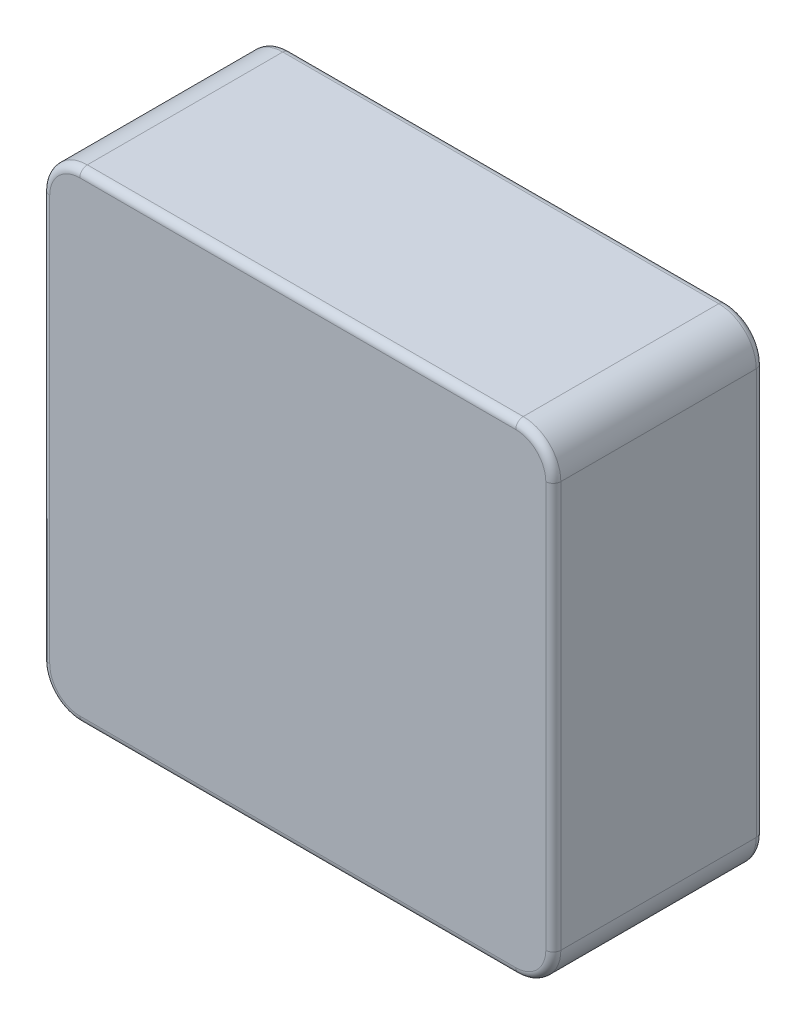
from build123d import *

# Parameters (mm, degrees)
BOSS_EXTRUDE1_DEPTH = 2.8
SKETCH2_W           = 5.05
SKETCH2_H           = 1.4
BOSS_EXTRUDE2_DEPTH = 0.1
FILLET1_R           = 0.1


with BuildPart() as part:
    # Sketch1 → Boss-Extrude1 (new body)
    with BuildSketch(Plane.XY):
        with BuildLine():
            Line((-2.9, -3.2), (2.9, -3.2))
            ThreePointArc((2.9, -3.2), (3.253553391, -3.053553391), (3.4, -2.7))
            Line((3.4, -2.7), (3.4, 2.7))
            ThreePointArc((3.4, 2.7), (3.253553391, 3.053553391), (2.9, 3.2))
            Line((2.9, 3.2), (-2.9, 3.2))
            ThreePointArc((-2.9, 3.2), (-3.253553391, 3.053553391), (-3.4, 2.7))
            Line((-3.4, 2.7), (-3.4, -2.7))
            ThreePointArc((-3.4, -2.7), (-3.253553391, -3.053553391), (-2.9, -3.2))
        make_face()
    extrude(amount=BOSS_EXTRUDE1_DEPTH)

    # Sketch2 → Boss-Extrude2 (add)
    with BuildSketch(Plane(origin=(0, 0, 0), x_dir=(-1, 0, 0), z_dir=(0, 0, -1))):
        with Locations((0, 2)):
            Rectangle(SKETCH2_W, SKETCH2_H)
        with Locations((0, -2)):
            Rectangle(SKETCH2_W, SKETCH2_H)
    extrude(amount=BOSS_EXTRUDE2_DEPTH)

    # Fillet1
    fillet1_edges = [part.edges().sort_by_distance(p)[0] for p in [
        (3.253553391, 3.053553391, 2.8),
        (3.4, 0, 0),
        (3.253553391, -3.053553391, 0),
        (0, 3.2, 2.8),
        (-3.253553391, 3.053553391, 2.8),
        (-3.4, 0, 2.8),
        (-3.253553391, -3.053553391, 2.8),
        (0, -3.2, 2.8),
        (3.253553391, -3.053553391, 2.8),
        (3.4, 0, 2.8),
        (0, -3.2, 0),
        (-3.253553391, -3.053553391, 0),
        (-3.4, 0, 0),
        (-3.253553391, 3.053553391, 0),
        (0, 3.2, 0),
        (3.253553391, 3.053553391, 0),
    ]]
    fillet(fillet1_edges, radius=FILLET1_R)


solid = part.part
